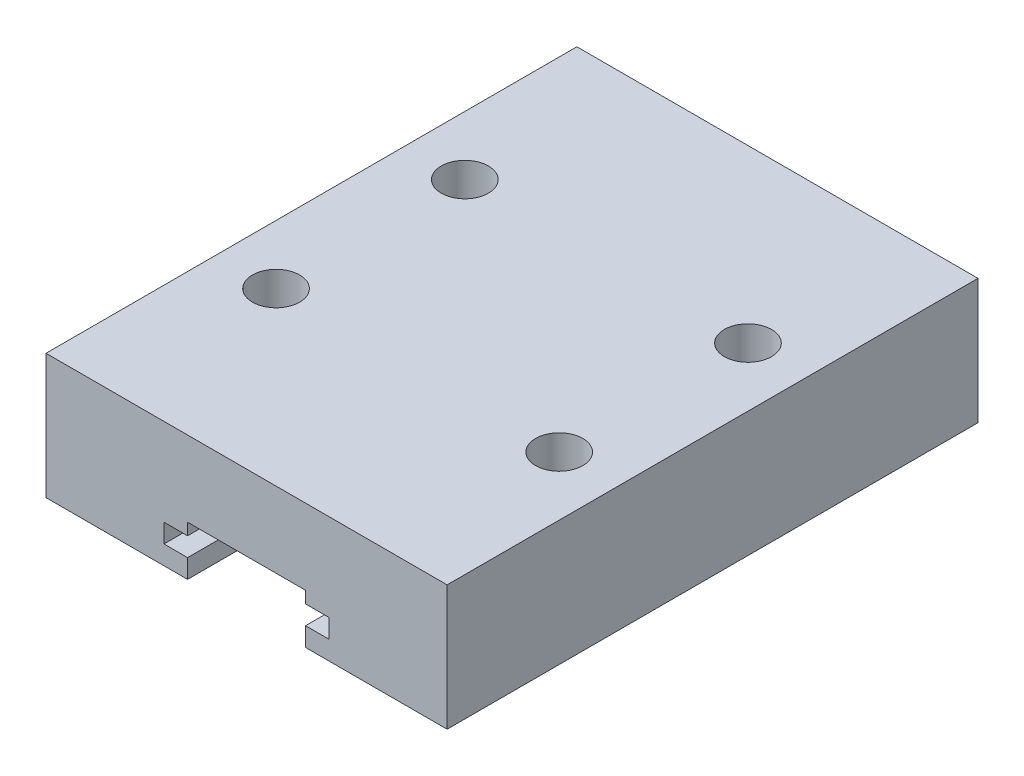
from build123d import *

# Parameters (mm, degrees)
EXTRUDE_1_DEPTH     = 22.5
SKETCH_4_R          = 1
CUT_EXTRUDE_4_DEPTH = 2


with BuildPart() as part:
    # 草图1 → 凸台-拉伸1 (new body)
    with BuildSketch(Plane.XY):
        Polygon((-18.065809082, -5.18088445), (-18.065809082, -10.48088445), (-12.065809082, -10.48088445), (-12.065809082, -9.68088445), (-13.065809082, -9.68088445), (-13.065809082, -8.88088445), (-12.065809082, -8.88088445), (-12.065809082, -8.38088445), (-9.565809082, -8.38088445), (-9.565809082, -5.18088445), align=None)
        Polygon((-1.065809082, -5.18088445), (-9.565809082, -5.18088445), (-9.565809082, -8.38088445), (-7.065809082, -8.38088445), (-7.065809082, -8.88088445), (-6.065809082, -8.88088445), (-6.065809082, -9.68088445), (-7.065809082, -9.68088445), (-7.065809082, -10.48088445), (-1.065809082, -10.48088445), align=None)
    extrude(amount=EXTRUDE_1_DEPTH)

    # 草图4 → 切除-拉伸4 (cut)
    with BuildSketch(Plane(origin=(0, -5.18088445, 0), x_dir=(1, 0, 0), z_dir=(0, 1, 0))):
        with Locations(Location((-15.565809082, -7.25, 0), (0, 0, 270))):
            Circle(SKETCH_4_R)
        with Locations(Location((-15.565809082, -15.25, 0), (0, 0, 270))):
            Circle(SKETCH_4_R)
        with Locations(Location((-3.565809082, -7.25, 0), (0, 0, 270))):
            Circle(SKETCH_4_R)
        with Locations(Location((-3.565809082, -15.25, 0), (0, 0, 270))):
            Circle(SKETCH_4_R)
    extrude(amount=-CUT_EXTRUDE_4_DEPTH, mode=Mode.SUBTRACT)


solid = part.part
